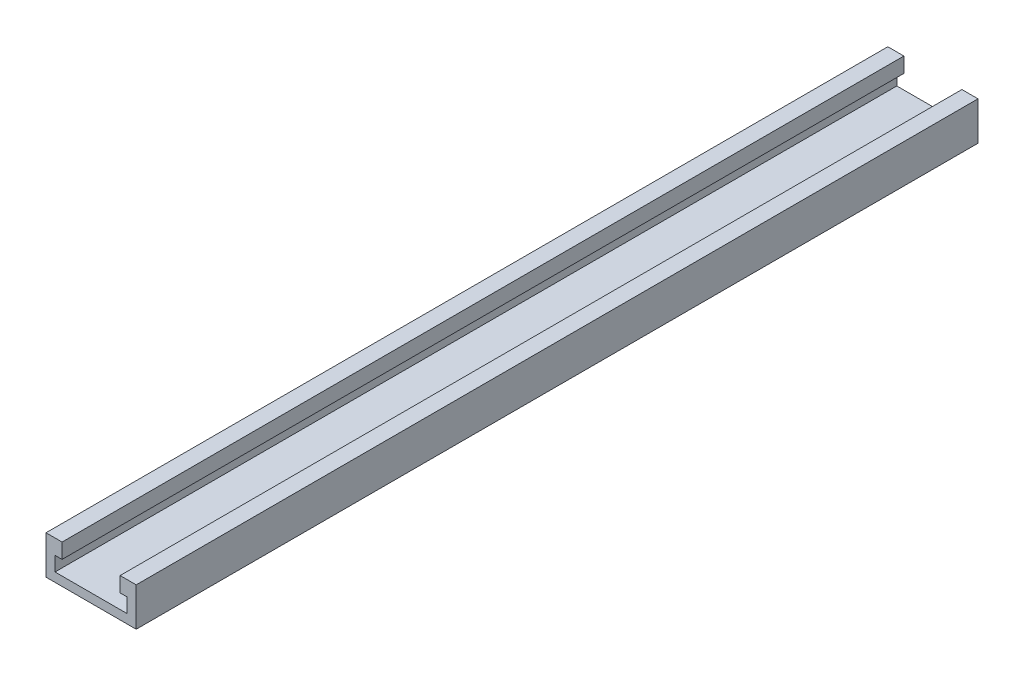
from build123d import *

# Parameters (mm, degrees)
BOSS_EXTRU_1_DEPTH = 280


with BuildPart() as part:
    # Esquisse1 → Boss.-Extru.1 (new body)
    with BuildSketch(Plane.XY):
        Polygon((-15, 0), (15, 0), (15, 12.8), (9.65, 12.8), (9.65, 7.8), (12, 7.8), (12, 3), (-12, 3), (-12, 7.8), (-9.65, 7.8), (-9.65, 12.8), (-15, 12.8), align=None)
    extrude(amount=BOSS_EXTRU_1_DEPTH)


solid = part.part
